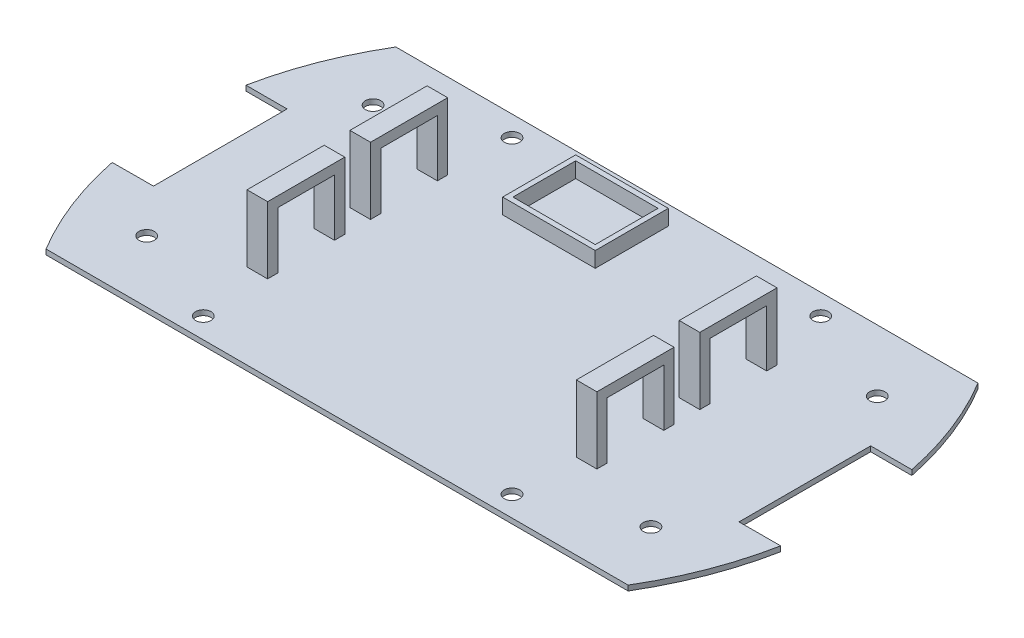
from build123d import *

# Parameters (mm, degrees)
EXTRUDE_2_DEPTH             = 1
F_3_0MM_1_D                 = 3
F_3_0MM_1_DEPTH             = 4
F_3_0MM_1_TIP               = 0.901290929
F_3_0MM_1_ON_FACE_2_D       = 3
F_3_0MM_1_ON_FACE_2_DEPTH   = 4
F_3_0MM_1_ON_FACE_2_TIP     = 0.901290929
PATTERN_LINEAR_1_COUNT      = 2
PATTERN_LINEAR_1_PITCH      = 98
PATTERN_LINEAR_1_COUNT_DIR2 = 2
PATTERN_LINEAR_1_PITCH_DIR2 = 44
SKETCH_16_W                 = 4
SKETCH_16_H                 = 15
EXTRUDE_3_DEPTH             = 13
CUT_EXTRUDE_1_REACH         = 107.413
SKETCH_17_W                 = 11
SKETCH_17_H                 = 11
SKETCH_18_W                 = 18
SKETCH_18_H                 = 14.2
SKETCH_18_W_2               = 16
SKETCH_18_H_2               = 12.2
EXTRUDE_4_DEPTH             = 3


with BuildPart() as part:
    # 草圖10 → 填料-伸長2 (new body)
    with BuildSketch(Plane(origin=(0, 0, 0), x_dir=(1, 0, 0), z_dir=(0, 1, 0))):
        with BuildLine():
            Line((56.568542495, 34), (-56.568542495, 34))
            ThreePointArc((-56.568542495, 34), (-61.540159626, 23.849711805), (-64.707032075, 13))
            Line((-64.707032075, 13), (-56.707032075, 13))
            Line((-56.707032075, 13), (-56.707032075, -12.973279994))
            Line((-56.707032075, -12.973279994), (-64.707032075, -13))
            ThreePointArc((-64.707032075, -13), (-61.540159626, -23.849711805), (-56.568542495, -34))
            Line((-56.568542495, -34), (56.568542495, -34))
            ThreePointArc((56.568542495, -34), (61.619473981, -23.644035746), (64.792427449, -12.567471713))
            Line((64.792427449, -12.567471713), (56.707032075, -12.594476939))
            Line((56.707032075, -12.594476939), (56.707032075, 13))
            Line((56.707032075, 13), (64.707032075, 13))
            ThreePointArc((64.707032075, 13), (61.540159626, 23.849711805), (56.568542495, 34))
        make_face()
    extrude(amount=EXTRUDE_2_DEPTH)

    # Ø3.0mm 定位孔1
    with Locations(Plane(origin=(30, 1, 30), x_dir=(0, 0, 1), z_dir=(0, 1, 0))):
        with Locations((0, 0), (-60, -60), (0, -60), (-60, 0)):
            Hole(F_3_0MM_1_D / 2, depth=F_3_0MM_1_DEPTH)
            with Locations((0, 0, -(F_3_0MM_1_DEPTH + F_3_0MM_1_TIP / 2))):  # 118° drill point
                Cone(0, F_3_0MM_1_D / 2, F_3_0MM_1_TIP, mode=Mode.SUBTRACT)

    # Ø3.0mm 定位孔1 on face 2
    with Locations(Plane(origin=(-30, 0, -30), x_dir=(0, 0, -1), z_dir=(0, -1, 0))):
        with Locations((0, 0)):
            Hole(F_3_0MM_1_ON_FACE_2_D / 2, depth=F_3_0MM_1_ON_FACE_2_DEPTH)
            with Locations((0, 0, -(F_3_0MM_1_ON_FACE_2_DEPTH + F_3_0MM_1_ON_FACE_2_TIP / 2))):  # 118° drill point
                Cone(0, F_3_0MM_1_ON_FACE_2_D / 2, F_3_0MM_1_ON_FACE_2_TIP, mode=Mode.SUBTRACT)

    # 草圖14 → Ø3.0mm 定位孔2 (revolve, cut)
    with BuildSketch(Plane(origin=(-49, 1, -22), x_dir=(0, 0, 1), z_dir=(1, 0, 0))):
        Polygon((0, 0), (0, 4.901290929), (1.5, 4), (1.5, 0), align=None)
    f_3_0mm_2 = revolve(axis=Axis((-49, 7.35, -22), (0, -1, 0)), mode=Mode.SUBTRACT)

    # 直線複製排列1: 3.0mm _2 2 × 2
    with Locations(*[(i * PATTERN_LINEAR_1_PITCH, 0, j * PATTERN_LINEAR_1_PITCH_DIR2) for i in range(PATTERN_LINEAR_1_COUNT) for j in range(PATTERN_LINEAR_1_COUNT_DIR2) if (i, j) != (0, 0)]):
        add(f_3_0mm_2, mode=Mode.SUBTRACT)

    # 草圖16 → 填料-伸長3 (add)
    with BuildSketch(Plane(origin=(0, 1, 0), x_dir=(1, 0, 0), z_dir=(0, 1, 0))):
        with Locations((-32, 10)):
            Rectangle(SKETCH_16_W, SKETCH_16_H)
        with Locations((32, 10)):
            Rectangle(SKETCH_16_W, SKETCH_16_H)
        with Locations((32, -10)):
            Rectangle(SKETCH_16_W, SKETCH_16_H)
        with Locations((-32, -10)):
            Rectangle(SKETCH_16_W, SKETCH_16_H)
    extrude(amount=EXTRUDE_3_DEPTH)

    # 除料-伸長1: up to this face of the body (flat: up to its plane)
    cut_extrude_1_end = Plane(part.part.faces().sort_by_distance((34, 7.5, -10))[0])
    # 草圖17 → 除料-伸長1 (cut, up to the picked face)
    with BuildSketch(Plane.ZY.offset(34), mode=Mode.PRIVATE) as cut_extrude_1_sk1:
        with Locations((-10, 6.5)):
            Rectangle(SKETCH_17_W, SKETCH_17_H)
    cut_extrude_1_tool1 = split(extrude(cut_extrude_1_sk1.sketch, amount=-CUT_EXTRUDE_1_REACH, mode=Mode.PRIVATE), bisect_by=cut_extrude_1_end, keep=Keep.BOTH, mode=Mode.PRIVATE)
    # 草圖17 → 除料-伸長1 (cut, up to the picked face)
    with BuildSketch(Plane.ZY.offset(34), mode=Mode.PRIVATE) as cut_extrude_1_sk2:
        with Locations((10, 6.5)):
            Rectangle(SKETCH_17_W, SKETCH_17_H)
    cut_extrude_1_tool2 = split(extrude(cut_extrude_1_sk2.sketch, amount=-CUT_EXTRUDE_1_REACH, mode=Mode.PRIVATE), bisect_by=cut_extrude_1_end, keep=Keep.BOTH, mode=Mode.PRIVATE)
    add(cut_extrude_1_tool1.solids().sort_by(Axis((-34, 6.5, -10), (1, 0, 0)))[0], mode=Mode.SUBTRACT)
    add(cut_extrude_1_tool2.solids().sort_by(Axis((-34, 6.5, 10), (1, 0, 0)))[0], mode=Mode.SUBTRACT)

    # 草圖18 → 填料-伸長4 (add)
    with BuildSketch(Plane(origin=(0, 1, 0), x_dir=(1, 0, 0), z_dir=(0, 1, 0))):
        with Locations((-8.938019144, 23.21731374)):
            Rectangle(SKETCH_18_W, SKETCH_18_H)
        with Locations((-8.938019144, 23.21731374)):
            Rectangle(SKETCH_18_W_2, SKETCH_18_H_2, mode=Mode.SUBTRACT)
    extrude(amount=EXTRUDE_4_DEPTH)


solid = part.part
